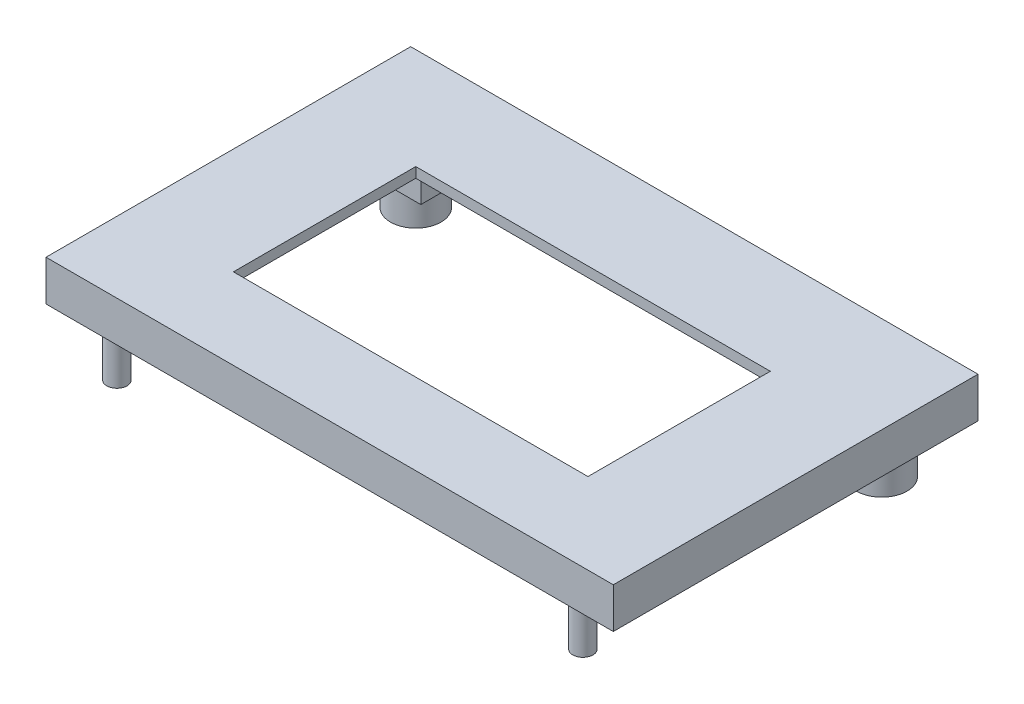
from build123d import *

# Parameters (mm, degrees)
SKETCH_1_W      = 56
SKETCH_1_H      = 36
EXTRUDE_3_DEPTH = 3
SKETCH_2_W      = 56
SKETCH_2_H      = 36
SKETCH_2_W_2    = 35
SKETCH_2_H_2    = 18
EXTRUDE_4_DEPTH = 1
SKETCH_3_R      = 1
SKETCH_3_R_2    = 2.5
EXTRUDE_5_DEPTH = 5


with BuildPart() as part:
    # 草图1 → 凸台-拉伸3 (new body)
    with BuildSketch(Plane(origin=(0, 0, 0), x_dir=(1, 0, 0), z_dir=(0, 1, 0))):
        with Locations((28, -18)):
            Rectangle(SKETCH_1_W, SKETCH_1_H)
        Polygon((10, -32), (1, -32), (1, -9), (10, -9), (10, -1), (46, -1), (46, -9), (55, -9), (55, -32), (46, -32), (46, -35), (10, -35), align=None, mode=Mode.SUBTRACT)
    extrude(amount=EXTRUDE_3_DEPTH)

    # 草图2 → 凸台-拉伸4 (add)
    with BuildSketch(Plane(origin=(0, 3, 0), x_dir=(1, 0, 0), z_dir=(0, 1, 0))):
        with Locations((28, -18)):
            Rectangle(SKETCH_2_W, SKETCH_2_H)
        with Locations((28, -19)):
            Rectangle(SKETCH_2_W_2, SKETCH_2_H_2, mode=Mode.SUBTRACT)
    extrude(amount=EXTRUDE_4_DEPTH)

    # 草图3 → 凸台-拉伸5 (add)
    with BuildSketch(Plane(origin=(0, 0, 0), x_dir=(-1, 0, 0), z_dir=(0, -1, 0))):
        with Locations(Location((-51, -34, 0), (0, 0, 270))):
            Circle(SKETCH_3_R)
        with Locations(Location((-5, -34, 0), (0, 0, 270))):
            Circle(SKETCH_3_R)
        with Locations(Location((-51, -4.5, 0), (0, 0, 270))):
            Circle(SKETCH_3_R_2)
        with Locations(Location((-5, -4.5, 0), (0, 0, 270))):
            Circle(SKETCH_3_R_2)
    extrude(amount=EXTRUDE_5_DEPTH)


solid = part.part
